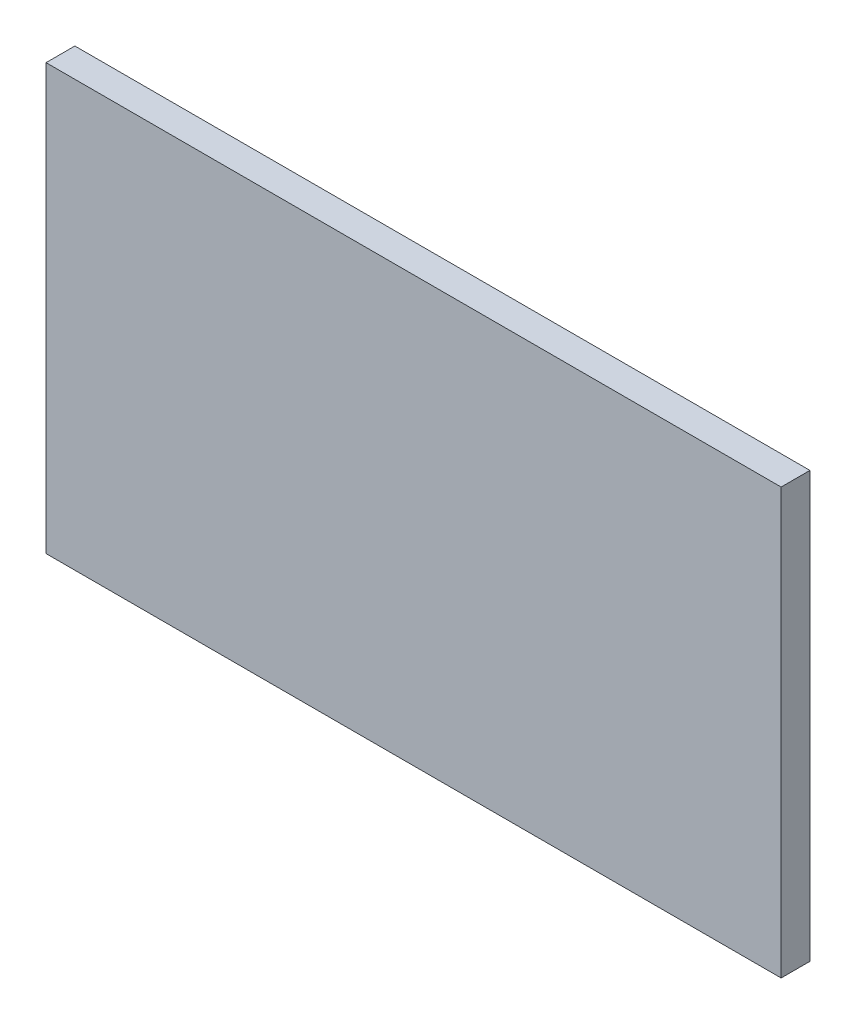
from build123d import *

# Parameters (mm, degrees)
CROQUIS1_W              = 1020
CROQUIS1_H              = 590
SALIENTE_EXTRUIR1_DEPTH = 40
CROQUIS2_R              = 7
CORTAR_EXTRUIR1_DEPTH   = 20


with BuildPart() as part:
    # Croquis1 → Saliente-Extruir1 (new body)
    with BuildSketch(Plane.XY):
        with Locations((510, 295)):
            Rectangle(CROQUIS1_W, CROQUIS1_H)
    extrude(amount=SALIENTE_EXTRUIR1_DEPTH)

    # Croquis2 → Cortar-Extruir1 (cut)
    with BuildSketch(Plane(origin=(0, 0, 0), x_dir=(-1, 0, 0), z_dir=(0, 0, -1))):
        with Locations((-70, 22.5)):
            Circle(CROQUIS2_R)
        with Locations((-70, 567.5)):
            Circle(CROQUIS2_R)
        with Locations((-950, 567.5)):
            Circle(CROQUIS2_R)
        with Locations((-950, 22.5)):
            Circle(CROQUIS2_R)
    extrude(amount=-CORTAR_EXTRUIR1_DEPTH, mode=Mode.SUBTRACT)


solid = part.part
